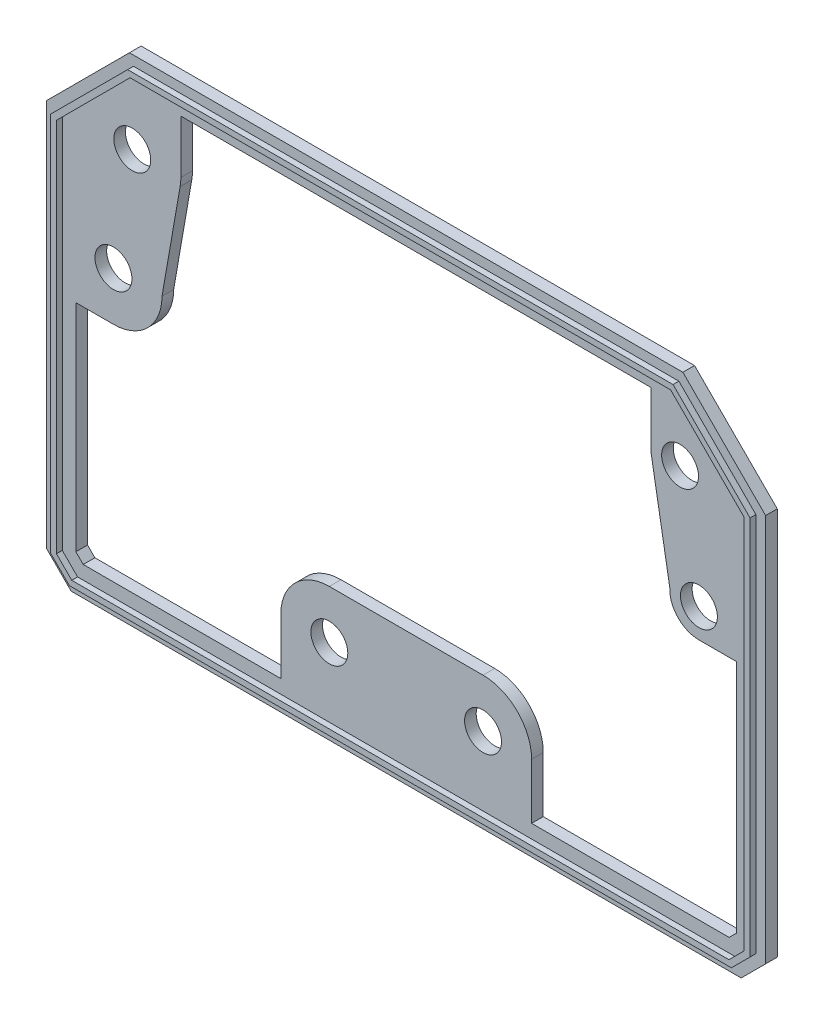
from build123d import *

# Parameters (mm, degrees)
SKETCH1_R           = 1.9
BOSS_EXTRUDE1_DEPTH = 1.2
BOSS_EXTRUDE2_DEPTH = 0.6


with BuildPart() as part:
    # Sketch1 → Boss-Extrude1 (new body)
    with BuildSketch(Plane.XY):
        Polygon((-68, 2.514718626), (-65.485281374, 0), (3.485281374, 0), (6, 2.514718626), (6, 42.485281374), (-2.514718626, 51), (-59.485281374, 51), (-68, 42.485281374), align=None)
        with Locations((-0.865721015, 30.964560447)):
            Circle(SKETCH1_R, mode=Mode.SUBTRACT)
        with Locations((-61.134278985, 30.964560447)):
            Circle(SKETCH1_R, mode=Mode.SUBTRACT)
        with Locations((-38.909782256, 8.710806253)):
            Circle(SKETCH1_R, mode=Mode.SUBTRACT)
        with Locations((-23.090217744, 8.710806253)):
            Circle(SKETCH1_R, mode=Mode.SUBTRACT)
        with Locations((-2.804444182, 42.527253566)):
            Circle(SKETCH1_R, mode=Mode.SUBTRACT)
        with Locations((-59.195555818, 42.527253566)):
            Circle(SKETCH1_R, mode=Mode.SUBTRACT)
        with BuildLine():
            Line((3, 27.964560447), (-0.865721015, 27.964560447))
            ThreePointArc((-0.865721015, 27.964560447), (-3.039785544, 28.897329588), (-3.861916537, 31.115598164))
            Line((-3.861916537, 31.115598164), (-5.759945542, 42.01246068))
            ThreePointArc((-5.759945542, 42.01246068), (-5.793298819, 42.268897298), (-5.804444182, 42.527253566))
            Line((-5.804444182, 42.527253566), (-5.804444182, 48))
            Line((-5.804444182, 48), (-54.195555818, 48))
            Line((-54.195555818, 48), (-54.195555818, 42.527253566))
            ThreePointArc((-54.195555818, 42.527253566), (-54.214131423, 42.096659786), (-54.269720219, 41.669265423))
            Line((-54.269720219, 41.669265423), (-56.134278985, 30.964560447))
            ThreePointArc((-56.134278985, 30.964560447), (-57.598745079, 27.429026541), (-61.134278985, 25.964560447))
            Line((-61.134278985, 25.964560447), (-65, 25.964560447))
            Line((-65, 25.964560447), (-65, 3.757359313))
            Line((-65, 3.757359313), (-64.242640687, 3))
            Line((-64.242640687, 3), (-43.909782256, 3))
            Line((-43.909782256, 3), (-43.909782256, 8.710806253))
            ThreePointArc((-43.909782256, 8.710806253), (-42.445316162, 12.246340159), (-38.909782256, 13.710806253))
            Line((-38.909782256, 13.710806253), (-23.090217744, 13.710806253))
            ThreePointArc((-23.090217744, 13.710806253), (-19.554683838, 12.246340159), (-18.090217744, 8.710806253))
            Line((-18.090217744, 8.710806253), (-18.090217744, 3))
            Line((-18.090217744, 3), (2.242640687, 3))
            Line((2.242640687, 3), (3, 3.757359313))
            Line((3, 3.757359313), (3, 27.964560447))
        make_face(mode=Mode.SUBTRACT)
    extrude(amount=BOSS_EXTRUDE1_DEPTH)

    # Sketch2 → Boss-Extrude2 (add)
    with BuildSketch(Plane.XY.offset(1.2)):
        Polygon((-67, 42.071067812), (-67, 2.928932188), (-65.071067812, 1), (3.071067812, 1), (5, 2.928932188), (5, 42.071067812), (-2.928932188, 50), (-59.071067812, 50), align=None)
        Polygon((-66.4, 41.822539674), (-66.4, 3.177460326), (-64.822539674, 1.6), (2.822539674, 1.6), (4.4, 3.177460326), (4.4, 41.822539674), (-3.177460326, 49.4), (-58.822539674, 49.4), align=None, mode=Mode.SUBTRACT)
    extrude(amount=BOSS_EXTRUDE2_DEPTH)


solid = part.part
